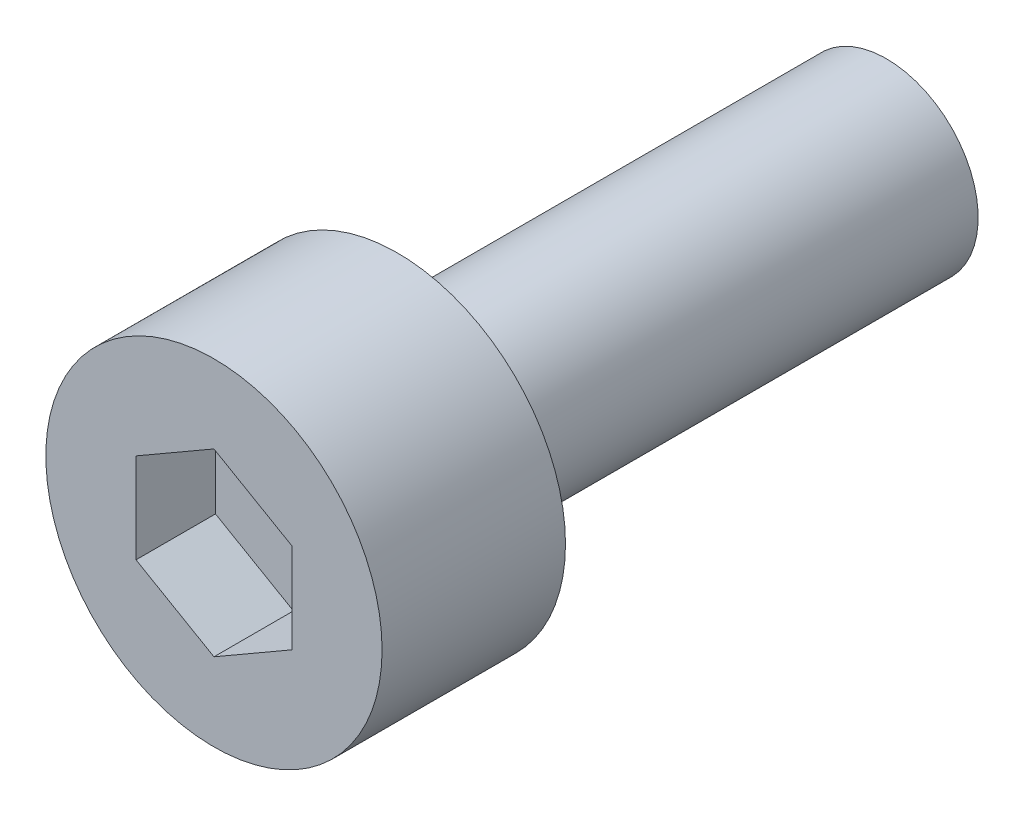
from build123d import *

# Parameters (mm, degrees)
SKETCH_1_R          = 2.75
EXTRUDE_1_DEPTH     = 3
CUT_EXTRUDE_1_DEPTH = 1.3
SKETCH_3_R          = 1.5
EXTRUDE_2_DEPTH     = 8


with BuildPart() as part:
    # 草图1 → 凸台-拉伸1 (new body)
    with BuildSketch(Plane.XY):
        Circle(SKETCH_1_R)
    extrude(amount=EXTRUDE_1_DEPTH)

    # 草图2 → 切除-拉伸1 (cut)
    with BuildSketch(Plane.XY.offset(3)):
        Polygon((1.275, -0.736121593), (1.275, 0.736121593), (0, 1.472243186), (-1.275, 0.736121593), (-1.275, -0.736121593), (0, -1.472243186), align=None)
    extrude(amount=-CUT_EXTRUDE_1_DEPTH, mode=Mode.SUBTRACT)

    # 草图3 → 凸台-拉伸2 (add)
    with BuildSketch(Plane(origin=(0, 0, 0), x_dir=(-1, 0, 0), z_dir=(0, 0, -1))):
        Circle(SKETCH_3_R)
    extrude(amount=EXTRUDE_2_DEPTH)


solid = part.part
